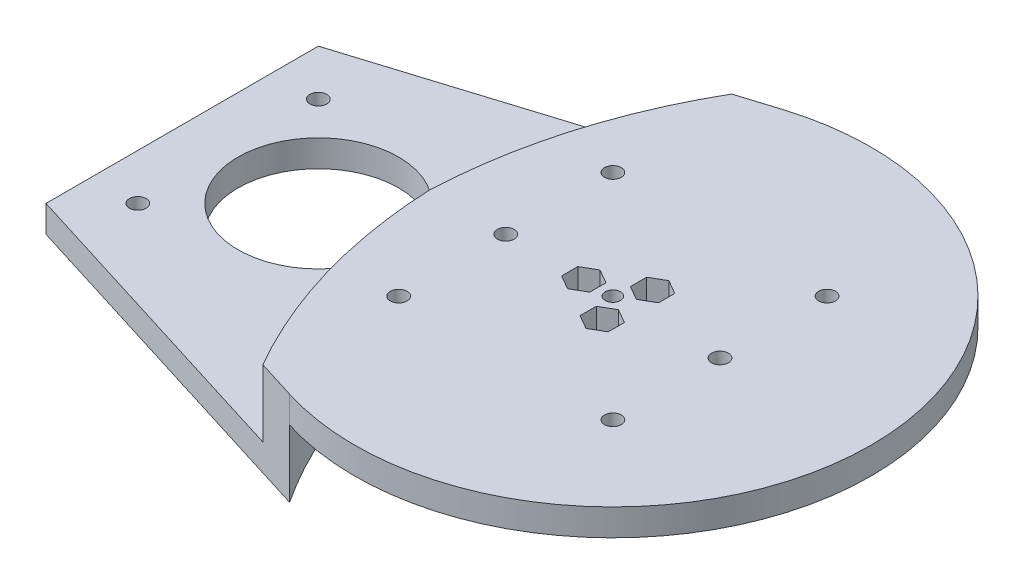
from build123d import *
from build123d.topology import SkipClean

# Parameters (mm, degrees)
SKETCH1_R           = 21
SKETCH1_R_2         = 2.2
BOSS_EXTRUDE1_DEPTH = 7
SKETCH3_R           = 11.25
SKETCH3_R_2         = 2
BOSS_EXTRUDE2_DEPTH = 14
CUT_EXTRUDE1_START  = -1.5
SKETCH4_R           = 11.25
SKETCH4_R_2         = 9.9
CUT_EXTRUDE1_DEPTH  = 1.5
SKETCH5_R           = 2.2
CUT_EXTRUDE2_DEPTH  = 133.951156445
CUT_EXTRUDE3_DEPTH  = 6.5
CUT_EXTRUDE4_START  = -10
SKETCH7_R           = 2
CUT_EXTRUDE4_DEPTH  = 10
SKETCH8_R           = 2.2
CUT_EXTRUDE5_DEPTH  = 133.951156445
SKETCH9_R           = 4.15
CUT_EXTRUDE6_DEPTH  = 3
BOSS_EXTRUDE3_START = 17.5
SKETCH10_R          = 21
SKETCH10_R_2        = 2.2
BOSS_EXTRUDE3_DEPTH = 17.5
CUT_EXTRUDE7_DEPTH  = 17.5


with BuildPart() as part:
    # Sketch1 → Boss-Extrude1 (new body)
    with BuildSketch(Plane(origin=(0, 0, 0), x_dir=(1, 0, 0), z_dir=(0, 1, 0))):
        with BuildLine():
            Line((-112.6, -35.6), (-112.6, 35.6))
            Line((-112.6, 35.6), (-20.090163155, 64.440944627))
            ThreePointArc((-20.090163155, 64.440944627), (67.5, 0), (-20.090163155, -64.440944627))
            Line((-20.090163155, -64.440944627), (-112.6, -35.6))
        make_face()
        with Locations(Location((-77, 0, 0), (0, 0, 270))):
            Circle(SKETCH1_R, mode=Mode.SUBTRACT)
        with Locations(Location((-100.6, 23.6, 0), (0, 0, 270))):
            Circle(SKETCH1_R_2, mode=Mode.SUBTRACT)
        with Locations(Location((-100.6, -23.6, 0), (0, 0, 270))):
            Circle(SKETCH1_R_2, mode=Mode.SUBTRACT)
        with Locations(Location((-53.4, -23.6, 0), (0, 0, 270))):
            Circle(SKETCH1_R_2, mode=Mode.SUBTRACT)
        with Locations(Location((-53.4, 23.6, 0), (0, 0, 270))):
            Circle(SKETCH1_R_2, mode=Mode.SUBTRACT)
    extrude(amount=BOSS_EXTRUDE1_DEPTH)

    # Sketch3 → Boss-Extrude2 (add)
    with BuildSketch(Plane.XZ):
        with Locations(Location((0, 0, 0), (0, 0, 90))):
            Circle(SKETCH3_R)
        with Locations(Location((0, 0, 0), (0, 0, 270))):
            Circle(SKETCH3_R_2, mode=Mode.SUBTRACT)
    extrude(amount=BOSS_EXTRUDE2_DEPTH)

    # Sketch4 → Cut-Extrude1 (cut)
    with BuildSketch(Plane.XZ.offset(14).offset(CUT_EXTRUDE1_START)):
        with Locations(Location((0, 0, 0), (0, 0, 90))):
            Circle(SKETCH4_R)
        with Locations(Location((0, 0, 0), (0, 0, 270))):
            Circle(SKETCH4_R_2, mode=Mode.SUBTRACT)
    extrude(amount=CUT_EXTRUDE1_DEPTH, mode=Mode.SUBTRACT)

    # Sketch5 → Cut-Extrude2 (cut, through all)
    with BuildSketch(Plane.XZ.offset(14)):
        with Locations(Location((-7.6, 0, 0), (0, 0, 270))):
            Circle(SKETCH5_R)
        with Locations(Location((3.8, 6.581793069, 0), (0, 0, 270))):
            Circle(SKETCH5_R)
        with Locations(Location((3.8, -6.581793069, 0), (0, 0, 270))):
            Circle(SKETCH5_R)
    extrude(amount=-CUT_EXTRUDE2_DEPTH, mode=Mode.SUBTRACT)

    # Sketch6 → Cut-Extrude3 (cut)
    with BuildSketch(Plane(origin=(0, 7, 0), x_dir=(1, 0, 0), z_dir=(0, 1, 0))):
        Polygon((3.8, 2.33826859), (7.475, 4.460030829), (7.475, 8.703555308), (3.8, 10.825317547), (0.125, 8.703555308), (0.125, 4.460030829), align=None)
        Polygon((-7.6, -4.243524479), (-3.925, -2.121762239), (-3.925, 2.121762239), (-7.6, 4.243524479), (-11.275, 2.121762239), (-11.275, -2.121762239), align=None)
        Polygon((0.125, -4.460030829), (0.125, -8.703555308), (3.8, -10.825317547), (7.475, -8.703555308), (7.475, -4.460030829), (3.8, -2.33826859), align=None)
    extrude(amount=-CUT_EXTRUDE3_DEPTH, mode=Mode.SUBTRACT)

    # Sketch7 → Cut-Extrude4 (cut)
    with BuildSketch(Plane.XZ.offset(CUT_EXTRUDE4_START)):
        with Locations(Location((0, 0, 0), (0, 0, 90))):
            Circle(SKETCH7_R)
    extrude(amount=CUT_EXTRUDE4_DEPTH, mode=Mode.SUBTRACT)

    # Sketch8 → Cut-Extrude5 (cut, through all)
    with BuildSketch(Plane(origin=(0, 7, 0), x_dir=(1, 0, 0), z_dir=(0, 1, 0))):
        with Locations(Location((-28, 0, 0), (0, 0, 270))):
            Circle(SKETCH8_R)
        with Locations(Location((28, 0, 0), (0, 0, 270))):
            Circle(SKETCH8_R)
        with Locations(Location((28, 28, 0), (0, 0, 270))):
            Circle(SKETCH8_R)
        with Locations(Location((-28, 28, 0), (0, 0, 270))):
            Circle(SKETCH8_R)
        with Locations(Location((-28, -28, 0), (0, 0, 270))):
            Circle(SKETCH8_R)
        with Locations(Location((28, -28, 0), (0, 0, 270))):
            Circle(SKETCH8_R)
    extrude(amount=-CUT_EXTRUDE5_DEPTH, mode=Mode.SUBTRACT)

    # Sketch9 → Cut-Extrude6 (cut)
    with BuildSketch(Plane.XZ):
        with Locations(Location((-28, 28, 0), (0, 0, 270))):
            Circle(SKETCH9_R)
        with Locations(Location((28, 28, 0), (0, 0, 270))):
            Circle(SKETCH9_R)
        with Locations(Location((-28, 0, 0), (0, 0, 270))):
            Circle(SKETCH9_R)
        with Locations(Location((28, 0, 0), (0, 0, 270))):
            Circle(SKETCH9_R)
        with Locations(Location((-28, -28, 0), (0, 0, 270))):
            Circle(SKETCH9_R)
        with Locations(Location((28, -28, 0), (0, 0, 270))):
            Circle(SKETCH9_R)
    extrude(amount=-CUT_EXTRUDE6_DEPTH, mode=Mode.SUBTRACT)

    # Sketch10 → Boss-Extrude3 (add)
    with SkipClean():  # the faces are left unmerged after this step: merging them gives an invalid solid
        with BuildSketch(Plane.XZ.offset(BOSS_EXTRUDE3_START)):
            with BuildLine():
                Line((-20.090163155, -64.440944627), (-112.6, -35.6))
                Line((-112.6, -35.6), (-112.6, 35.6))
                Line((-112.6, 35.6), (-20.090163155, 64.440944627))
                add(Edge.make_bspline(
                    [(-20.090163155, 64.440944627), (-39.318301135, 35.015813189), (-40.987873114, 0)],
                    knots=[0, 0, 0, 1, 1, 1], degree=2))
                add(Edge.make_bspline(
                    [(-20.090163155, -64.440944627), (-39.318301135, -35.015813189), (-40.987873114, 0)],
                    knots=[0, 0, 0, 1, 1, 1], degree=2))
            make_face()
            with Locations(Location((-77, 0, 0), (0, 0, 270))):
                Circle(SKETCH10_R, mode=Mode.SUBTRACT)
            with Locations(Location((-100.6, 23.6, 0), (0, 0, 270))):
                Circle(SKETCH10_R_2, mode=Mode.SUBTRACT)
            with Locations(Location((-53.4, 23.6, 0), (0, 0, 270))):
                Circle(SKETCH10_R_2, mode=Mode.SUBTRACT)
            with Locations(Location((-53.4, -23.6, 0), (0, 0, 270))):
                Circle(SKETCH10_R_2, mode=Mode.SUBTRACT)
            with Locations(Location((-100.6, -23.6, 0), (0, 0, 270))):
                Circle(SKETCH10_R_2, mode=Mode.SUBTRACT)
        extrude(amount=-BOSS_EXTRUDE3_DEPTH)

    # Sketch11 → Cut-Extrude7 (cut)
    with BuildSketch(Plane(origin=(0, 7, 0), x_dir=(1, 0, 0), z_dir=(0, 1, 0))):
        with BuildLine():
            Line((-25.949987435, 68.270103726), (-139.321617663, 44.018727608))
            Line((-139.321617663, 44.018727608), (-144.313851883, -55.417541664))
            Line((-144.313851883, -55.417541664), (-25.949987435, -68.270103726))
            add(Edge.make_bspline(
                [(-47.995441412, -1e-09), (-47.925769838, -1.535411027), (-47.737002645, -4.611648854), (-47.165699577, -10.689341017), (-46.085583629, -18.188567618), (-44.203243401, -27.011172833), (-41.734657134, -35.6544225), (-38.681165485, -44.111018236), (-35.046062429, -52.374277572), (-31.533581002, -59.097437671), (-28.439841721, -64.370244449), (-26.792175769, -66.981289258), (-25.949987435, -68.270103726)],
                knots=[0.498938173, 0.498938173, 0.498938173, 0.498938173, 0.499072926, 0.49920768, 0.499477188, 0.499746696, 0.500016204, 0.500285712, 0.50055522, 0.500824727, 0.500959481, 0.501094235, 0.501094235, 0.501094235, 0.501094235], degree=3))
            add(Edge.make_bspline(
                [(-25.949987435, 68.270103726), (-26.792175769, 66.981289258), (-28.439841721, 64.370244449), (-31.533581002, 59.097437671), (-35.046062429, 52.374277572), (-38.681165485, 44.111018235), (-41.734657134, 35.654422499), (-44.203243402, 27.011172832), (-46.085583629, 18.188567617), (-47.165699577, 10.689341015), (-47.737002645, 4.611648852), (-47.925769838, 1.535411025), (-47.995441412, -1e-09)],
                knots=[0.498905765, 0.498905765, 0.498905765, 0.498905765, 0.499040519, 0.499175273, 0.49944478, 0.499714288, 0.499983796, 0.500253304, 0.500522812, 0.50079232, 0.500927074, 0.501061827, 0.501061827, 0.501061827, 0.501061827], degree=3))
        make_face()
    extrude(amount=-CUT_EXTRUDE7_DEPTH, mode=Mode.SUBTRACT)


solid = part.part
